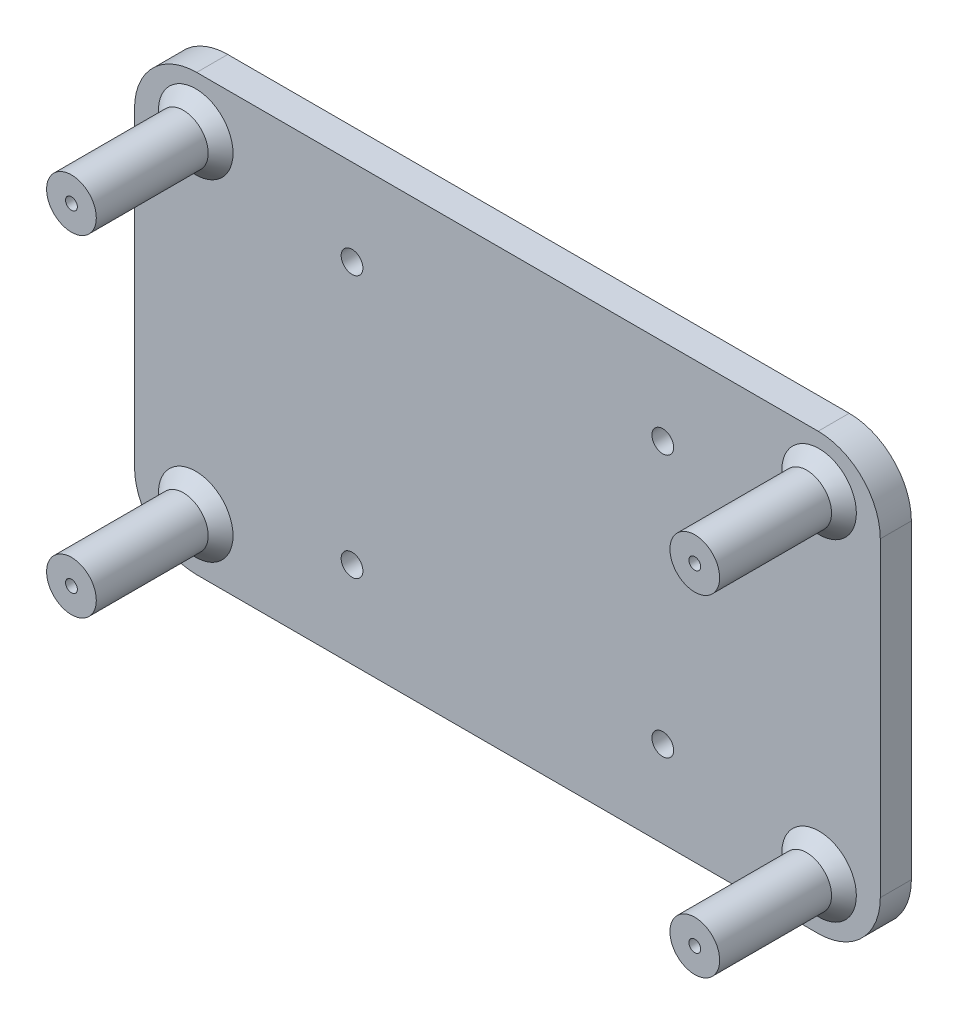
from build123d import *

# Parameters (mm, degrees)
SCHIZZO1_W                   = 120
SCHIZZO1_H                   = 70
ESTRUSIONE_ESTRUSIONE1_DEPTH = 5
SCHIZZO2_R                   = 4
ESTRUSIONE_ESTRUSIONE2_DEPTH = 20
SMUSSO1_SIZE                 = 2
SCHIZZO3_R                   = 0.95
TAGLIO_ESTRUSIONE1_DEPTH     = 15
RACCORDO1_R                  = 10
SCHIZZO4_R                   = 1.75
TAGLIO_ESTRUSIONE2_DEPTH     = 10


with BuildPart() as part:
    # Schizzo1 → Estrusione-Estrusione1 (new body)
    with BuildSketch(Plane.XY):
        Rectangle(SCHIZZO1_W, SCHIZZO1_H)
    extrude(amount=ESTRUSIONE_ESTRUSIONE1_DEPTH)

    # Schizzo2 → Estrusione-Estrusione2 (add)
    with BuildSketch(Plane.XY.offset(5)):
        with Locations((-50.15, 26.65)):
            Circle(SCHIZZO2_R)
        with Locations((50.15, -26.65)):
            Circle(SCHIZZO2_R)
        with Locations((50.15, 26.65)):
            Circle(SCHIZZO2_R)
        with Locations((-50.15, -26.65)):
            Circle(SCHIZZO2_R)
    extrude(amount=ESTRUSIONE_ESTRUSIONE2_DEPTH)

    # Smusso1
    smusso1_edges = [part.edges().sort_by_distance(p)[0] for p in [
        (-54.15, 26.65, 5),
        (46.15, -26.65, 5),
        (46.15, 26.65, 5),
        (-54.15, -26.65, 5),
    ]]
    chamfer(smusso1_edges, length=SMUSSO1_SIZE)

    # Schizzo3 → Taglio-Estrusione1 (cut)
    with BuildSketch(Plane.XY.offset(25)):
        with Locations((-50.15, 26.65)):
            Circle(SCHIZZO3_R)
        with Locations((50.15, 26.65)):
            Circle(SCHIZZO3_R)
        with Locations((50.15, -26.65)):
            Circle(SCHIZZO3_R)
        with Locations((-50.15, -26.65)):
            Circle(SCHIZZO3_R)
    extrude(amount=-TAGLIO_ESTRUSIONE1_DEPTH, mode=Mode.SUBTRACT)

    # Raccordo1
    raccordo1_edges = [part.edges().sort_by_distance(p)[0] for p in [
        (-60, 35, 2.5),
        (60, 35, 2.5),
        (60, -35, 2.5),
        (-60, -35, 2.5),
    ]]
    fillet(raccordo1_edges, radius=RACCORDO1_R)

    # Schizzo4 → Taglio-Estrusione2 (cut)
    with BuildSketch(Plane.XY.offset(5)):
        with Locations((-25, 21.101703565)):
            Circle(SCHIZZO4_R)
        with Locations((25, 21.101703565)):
            Circle(SCHIZZO4_R)
        with Locations((25, -21.101703565)):
            Circle(SCHIZZO4_R)
        with Locations((-25, -21.101703565)):
            Circle(SCHIZZO4_R)
    extrude(amount=-TAGLIO_ESTRUSIONE2_DEPTH, mode=Mode.SUBTRACT)


solid = part.part
